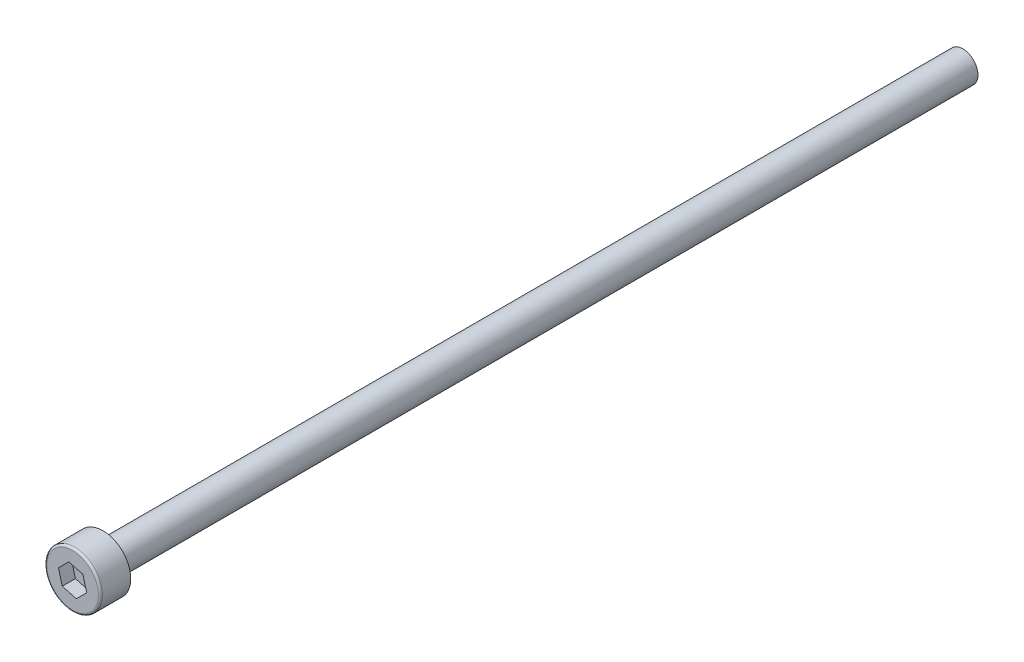
from build123d import *

# Parameters (mm, degrees)
SKETCH_1_R          = 2.75
EXTRUDE_1_DEPTH     = 3
CUT_EXTRUDE_1_DEPTH = 1.3
SKETCH_3_R          = 1.5
EXTRUDE_2_DEPTH     = 85
FILLET_1_R          = 0.2


with BuildPart() as part:
    # 草图1 → 凸台-拉伸1 (new body)
    with BuildSketch(Plane.XY):
        Circle(SKETCH_1_R)
    extrude(amount=EXTRUDE_1_DEPTH)

    # 草图2 → 切除-拉伸1 (cut)
    with BuildSketch(Plane.XY.offset(3)):
        Polygon((-1.020620726, -1.020620726), (0.373573113, -1.39419384), (1.39419384, -0.373573113), (1.020620726, 1.020620726), (-0.373573113, 1.39419384), (-1.39419384, 0.373573113), align=None)
    extrude(amount=-CUT_EXTRUDE_1_DEPTH, mode=Mode.SUBTRACT)

    # 草图3 → 凸台-拉伸2 (add)
    with BuildSketch(Plane(origin=(0, 0, 0), x_dir=(-1, 0, 0), z_dir=(0, 0, -1))):
        with Locations(Location((0, 0, 0), (0, 0, 180))):
            Circle(SKETCH_3_R)
    extrude(amount=EXTRUDE_2_DEPTH)

    # 圆角1
    fillet_1_edges = [part.edges().sort_by_distance(p)[0] for p in [
        (-2.75, 0, 3),
    ]]
    fillet(fillet_1_edges, radius=FILLET_1_R)


solid = part.part
